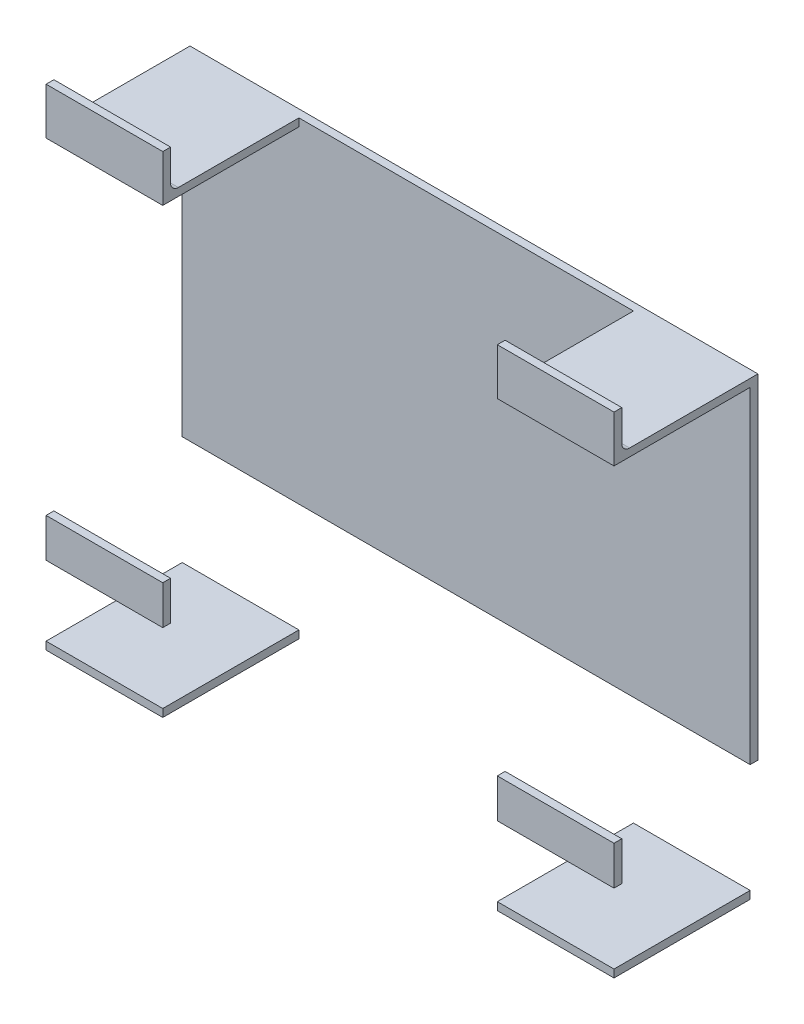
from build123d import *

# Parameters (mm, degrees)
ESQUISSE1_W          = 146
ESQUISSE1_H          = 86
BOSS_EXTRU_1_DEPTH   = 2
ESQUISSE2_W          = 30
ESQUISSE2_H          = 2
BOSS_EXTRU_2_DEPTH   = 35
ESQUISSE3_W          = 30
ESQUISSE3_H          = 2
BOSS_EXTRU_3_DEPTH   = 10
ESQUISSE4_W          = 30
ESQUISSE4_H          = 2
BOSS_EXTRU_4_DEPTH   = 10
BOSS_EXTRU_4_2_DEPTH = 10
CONG_1_R             = 2


with BuildPart() as part:
    # Esquisse1 → Boss.-Extru.1 (new body)
    with BuildSketch(Plane.XY):
        with Locations((0, 15)):
            Rectangle(ESQUISSE1_W, ESQUISSE1_H)
    extrude(amount=BOSS_EXTRU_1_DEPTH)

    # Esquisse2 → Boss.-Extru.2 (add)
    with BuildSketch(Plane.XY.offset(2)):
        with Locations((-58, 57)):
            Rectangle(ESQUISSE2_W, ESQUISSE2_H)
        with Locations((58, 57)):
            Rectangle(ESQUISSE2_W, ESQUISSE2_H)
        with Locations((58, -57)):
            Rectangle(ESQUISSE2_W, ESQUISSE2_H)
        with Locations((-58, -57)):
            Rectangle(ESQUISSE2_W, ESQUISSE2_H)
    extrude(amount=BOSS_EXTRU_2_DEPTH)


with BuildPart() as boss_extru_2_piece_1:
    # of the separate pieces the step leaves, piece 1, a body of its own (boss_extru_2_pieces)
    add(part.part.solids().sort_by_distance((-73, 58, 0))[0])

    # Esquisse3 → Boss.-Extru.3 (add)
    with BuildSketch(Plane(origin=(0, 58, 0), x_dir=(1, 0, 0), z_dir=(0, 1, 0))):
        with Locations((-58, -36)):
            Rectangle(ESQUISSE3_W, ESQUISSE3_H)
        with Locations((58, -36)):
            Rectangle(ESQUISSE3_W, ESQUISSE3_H)
    extrude(amount=BOSS_EXTRU_3_DEPTH)

    # Congé1
    cong_1_edges = [boss_extru_2_piece_1.edges().sort_by_distance(p)[0] for p in [
        (-58, 58, 35),
        (58, 58, 35),
    ]]
    fillet(cong_1_edges, radius=CONG_1_R)


with BuildPart() as boss_extru_2_piece_2:
    # of the separate pieces the step leaves, piece 2, a body of its own (boss_extru_2_pieces)
    add(part.part.solids().sort_by_distance((73, -58, 2))[0])


with BuildPart() as boss_extru_2_piece_3:
    # of the separate pieces the step leaves, piece 3, a body of its own (boss_extru_2_pieces)
    add(part.part.solids().sort_by_distance((-43, -58, 2))[0])


with BuildPart() as body_4:
    # Esquisse4 → Boss.-Extru.4 (new body)
    with BuildSketch(Plane.XZ.offset(28)):
        with Locations((-58, 36)):
            Rectangle(ESQUISSE4_W, ESQUISSE4_H)
    extrude(amount=BOSS_EXTRU_4_DEPTH)


with BuildPart() as body_5:
    # Esquisse4 → Boss.-Extru.4 2 (new body)
    with BuildSketch(Plane.XZ.offset(28)):
        with Locations((58, 36)):
            Rectangle(ESQUISSE4_W, ESQUISSE4_H)
    extrude(amount=BOSS_EXTRU_4_2_DEPTH)


solid = Compound([boss_extru_2_piece_1.part, boss_extru_2_piece_2.part, boss_extru_2_piece_3.part, body_4.part, body_5.part])
